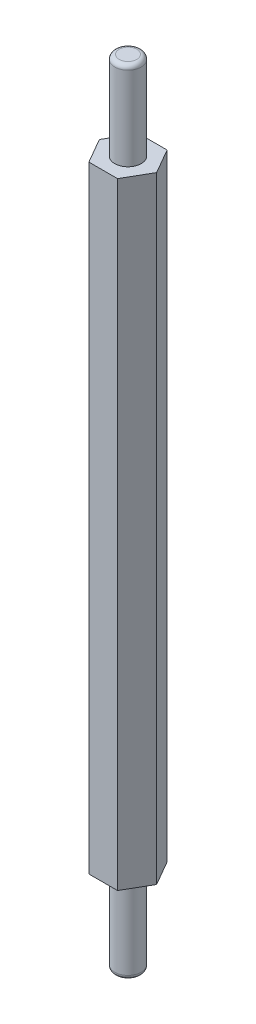
from build123d import *

# Parameters (mm, degrees)
SKETCH_1_R          = 1.5
EXTRUDE_1_DEPTH     = 90
FILLET_1_R          = 0.5
SKETCH_2_R          = 1.5
EXTRUDE_2_DEPTH     = 80
SKETCH_2_3_R        = 1.5
CUT_EXTRUDE_2_DEPTH = 10


with BuildPart() as part:
    # 草图1 → 凸台-拉伸1 (new body)
    with BuildSketch(Plane(origin=(0, 0, 0), x_dir=(1, 0, 0), z_dir=(0, 1, 0))):
        Circle(SKETCH_1_R)
    extrude(amount=EXTRUDE_1_DEPTH)

    # 圆角1
    fillet_1_edges = [part.edges().sort_by_distance(p)[0] for p in [
        (-1.5, 0, 0),
        (-1.5, 90, 0),
    ]]
    fillet(fillet_1_edges, radius=FILLET_1_R)

    # 草图2 → 凸台-拉伸2 (add)
    with BuildSketch(Plane(origin=(0, 0, 0), x_dir=(1, 0, 0), z_dir=(0, 1, 0))):
        Polygon((-1.625, 2.814582562), (-3.25, 0), (-1.625, -2.814582562), (1.625, -2.814582562), (3.25, 0), (1.625, 2.814582562), align=None)
        Circle(SKETCH_2_R, mode=Mode.SUBTRACT)
    extrude(amount=EXTRUDE_2_DEPTH)

    # 草图2<3> → 切除-拉伸2 (cut)
    with BuildSketch(Plane(origin=(0, 0, 0), x_dir=(1, 0, 0), z_dir=(0, 1, 0))):
        Polygon((-1.625, 2.814582562), (-3.25, 0), (-1.625, -2.814582562), (1.625, -2.814582562), (3.25, 0), (1.625, 2.814582562), align=None)
        Circle(SKETCH_2_3_R, mode=Mode.SUBTRACT)
    extrude(amount=CUT_EXTRUDE_2_DEPTH, mode=Mode.SUBTRACT)


solid = part.part
